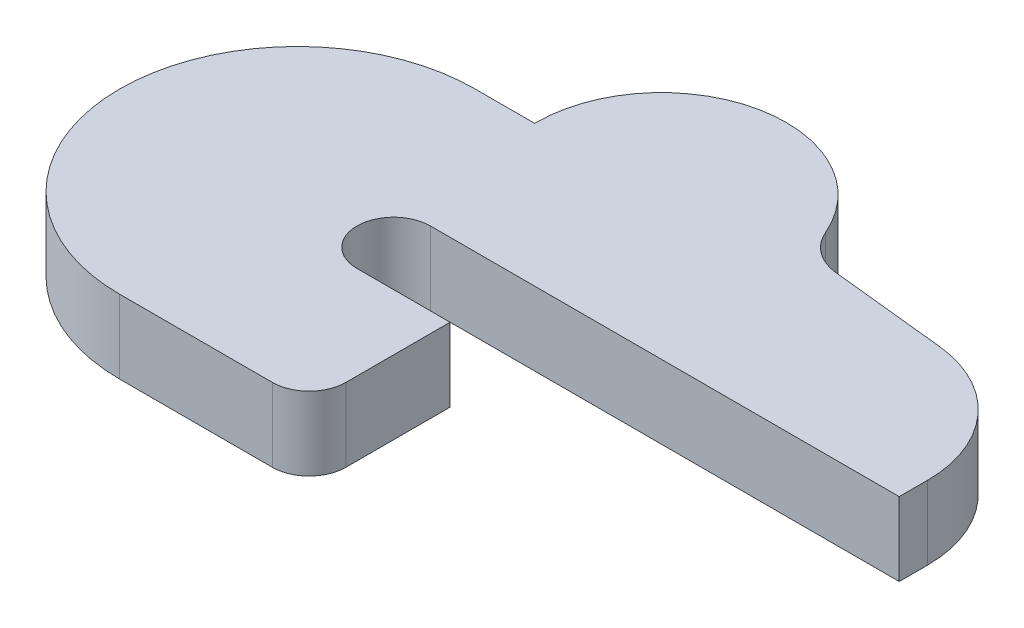
from build123d import *

# Parameters (mm, degrees)
BOSS_EXTRUDE2_DEPTH = 3


with BuildPart() as part:
    # Sketch1 → Boss-Extrude2 (new body)
    with BuildSketch(Plane(origin=(0, 0, 0), x_dir=(1, 0, 0), z_dir=(0, 1, 0))):
        with BuildLine():
            Line((0, 0), (-3.8, 0))
            ThreePointArc((-3.8, 0), (-5.3, 1.5), (-3.8, 3))
            Line((-3.8, 3), (15.32, 3))
            Line((15.32, 3), (15.32, 4.151365207))
            ThreePointArc((15.32, 4.151365207), (14.035724127, 7.497018238), (10.842642316, 9.123974683))
            Line((10.842642316, 9.123974683), (6.117396703, 9.62061801))
            ThreePointArc((6.117396703, 9.62061801), (5.139445253, 10), (4.488015988, 10.822167651))
            ThreePointArc((4.488015988, 10.822167651), (-1.224967917, 13.81), (-5.3, 8.81405757))
            Line((-5.3, 8.81405757), (-5.3, 8.75))
            Line((-5.3, 8.75), (-7.73, 8.75))
            ThreePointArc((-7.73, 8.75), (-14.98, 1.5), (-7.73, -5.75))
            Line((-7.73, -5.75), (-1.5, -5.75))
            ThreePointArc((-1.5, -5.75), (-0.439339828, -5.310660172), (0, -4.25))
            Line((0, -4.25), (0, 0))
        make_face()
    extrude(amount=BOSS_EXTRUDE2_DEPTH)


solid = part.part
